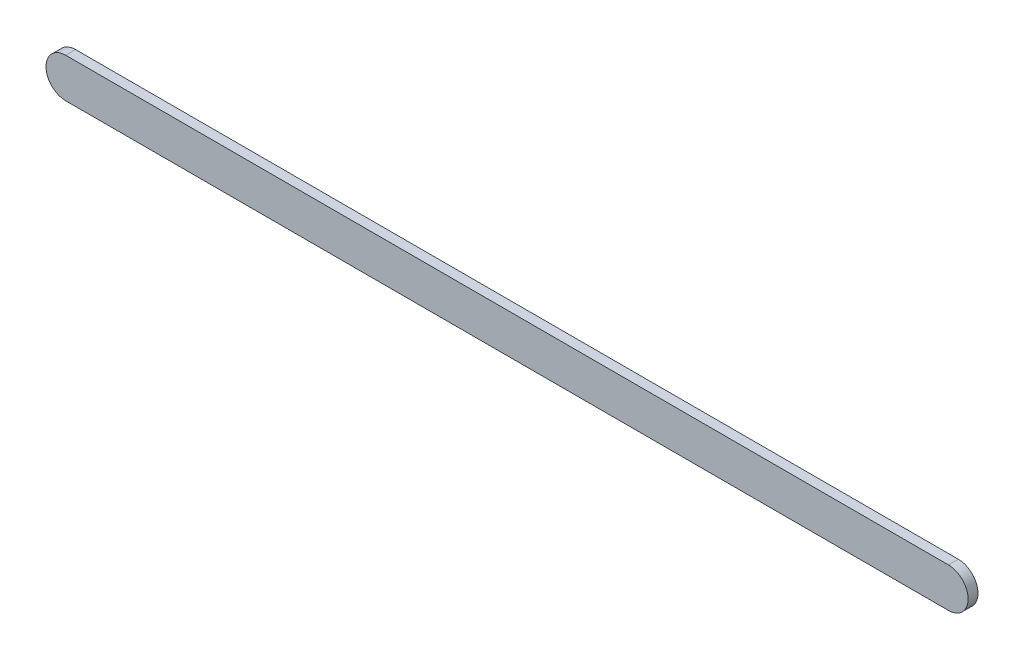
from build123d import *

# Parameters (mm, degrees)
BOSS_EXTRUDE1_DEPTH = 5


with BuildPart() as part:
    # Sketch1 → Boss-Extrude1 (new, symmetric)
    with BuildSketch(Plane.XY):
        with BuildLine():
            Line((0, -20), (-895, -20))
            ThreePointArc((-895, -20), (-915, 0), (-895, 20))
            Line((-895, 20), (0, 20))
            ThreePointArc((0, 20), (20, 0), (0, -20))
        make_face()
    extrude(amount=BOSS_EXTRUDE1_DEPTH, both=True)


solid = part.part
